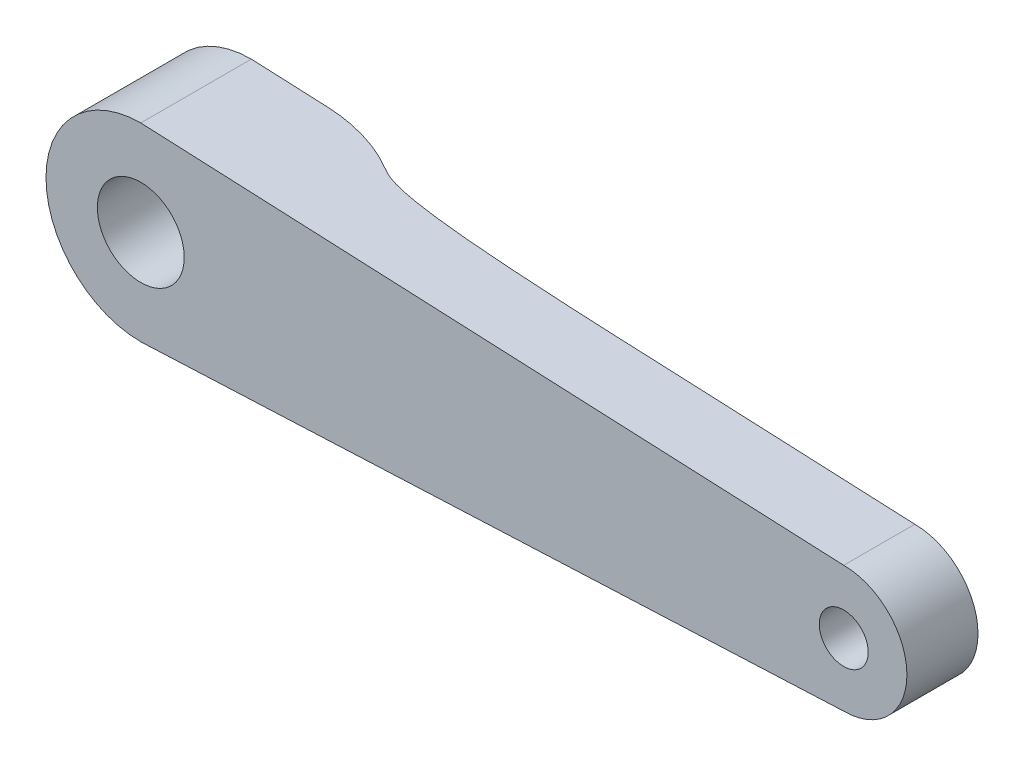
from build123d import *

# Parameters (mm, degrees)
SKETCH1_R               = 1.55
BOSS_EXTRUDE1_DEPTH     = 7
SKETCH2_R               = 2.75
CUT_EXTRUDE1_DEPTH      = 5
SKETCH3_R               = 1.75
CUT_EXTRUDE2_DEPTH      = 5
CUT_EXTRUDE4_DEPTH      = 50.368512232
CUT_EXTRUDE4_DEPTH_BACK = 50.368512232
FILLET1_R               = 10


with BuildPart() as part:
    # Sketch1 → Boss-Extrude1 (new body)
    with BuildSketch(Plane.XY):
        with BuildLine():
            Line((44.5, 4), (0, 6))
            ThreePointArc((0, 6), (-6, 0), (0, -6))
            Line((0, -6), (44.5, -4))
            ThreePointArc((44.5, -4), (48.5, 0), (44.5, 4))
        make_face()
        with Locations((44.5, 0)):
            Circle(SKETCH1_R, mode=Mode.SUBTRACT)
    extrude(amount=BOSS_EXTRUDE1_DEPTH)

    # Sketch2 → Cut-Extrude1 (cut)
    with BuildSketch(Plane.XY.offset(7)):
        Circle(SKETCH2_R)
    extrude(amount=-CUT_EXTRUDE1_DEPTH, mode=Mode.SUBTRACT)

    # Sketch3 → Cut-Extrude2 (cut)
    with BuildSketch(Plane(origin=(0, 0, 0), x_dir=(-1, 0, 0), z_dir=(0, 0, -1))):
        Circle(SKETCH3_R)
    extrude(amount=-CUT_EXTRUDE2_DEPTH, mode=Mode.SUBTRACT)

    # Sketch5 → Cut-Extrude4 (cut, two sides: drawn at the far end of the back side and taken through both)
    with BuildSketch(Plane(origin=(0, 0, 0), x_dir=(1, 0, 0), z_dir=(0, 1, 0)).offset(-CUT_EXTRUDE4_DEPTH_BACK)):
        with BuildLine():
            Line((48.5, 0), (48.5, -2.5))
            Line((48.5, -2.5), (28.5, -2.5))
            add(Edge.make_bspline(
                [(9, 0), (9.734542775, -1.732075598), (8.772191405, -2.578671179), (28.5, -2.5)],
                knots=[0, 0, 0, 0, 1, 1, 1, 1], degree=3))
            Line((9, 0), (48.5, 0))
        make_face()
    extrude(amount=CUT_EXTRUDE4_DEPTH + CUT_EXTRUDE4_DEPTH_BACK, mode=Mode.SUBTRACT)

    # Fillet1
    fillet1_edges = [part.edges().sort_by_distance(p)[0] for p in [
        (9, -2.797752809, 0),
    ]]
    fillet(fillet1_edges, radius=FILLET1_R)


solid = part.part
